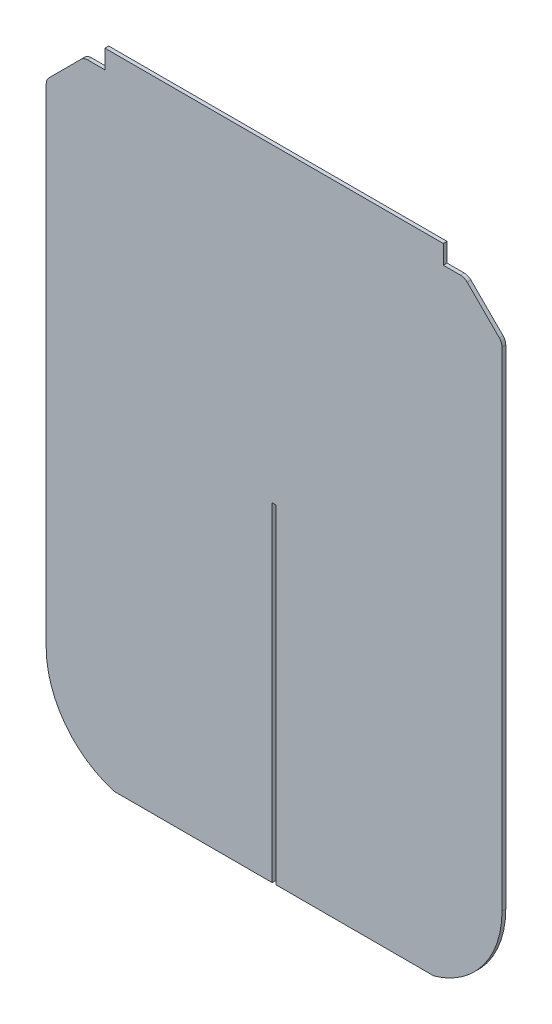
from build123d import *

# Parameters (mm, degrees)
BOSS_EXTRUDE1_DEPTH = 0.8
FILLET1_R           = 2


with BuildPart() as part:
    # Sketch1 → Boss-Extrude1 (new body)
    with BuildSketch(Plane.XY):
        with BuildLine():
            Line((14.5, 0), (48.1, 0))
            Line((48.1, 0), (48.1, 70))
            Line((48.1, 70), (48.9, 70))
            Line((48.9, 70), (48.9, 0))
            Line((48.9, 0), (82.5, 0))
            ThreePointArc((82.5, 0), (92.968719423, 7.187289944), (97, 19.228884523))
            Line((97, 19.228884523), (97, 124))
            Line((97, 124), (89, 132))
            Line((89, 132), (84.5, 132))
            Line((84.5, 132), (84.5, 136))
            Line((84.5, 136), (45.939865431, 136))
            Line((45.939865431, 136), (12.5, 136))
            Line((12.5, 136), (12.5, 132))
            Line((12.5, 132), (8, 132))
            Line((8, 132), (0, 124))
            Line((0, 124), (0, 19.228884523))
            ThreePointArc((0, 19.228884523), (4.031280577, 7.187289944), (14.5, 0))
        make_face()
    extrude(amount=BOSS_EXTRUDE1_DEPTH)

    # Fillet1
    fillet1_edges = [part.edges().sort_by_distance(p)[0] for p in [
        (89, 132, 0.4),
        (97, 124, 0.4),
        (0, 124, 0.4),
        (8, 132, 0.4),
    ]]
    fillet(fillet1_edges, radius=FILLET1_R)


solid = part.part
